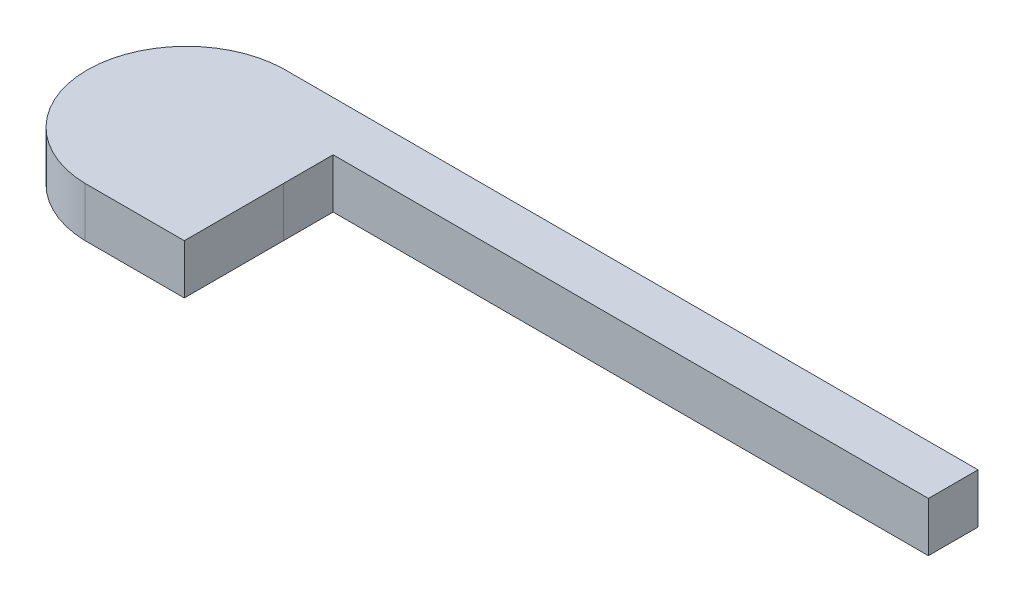
from build123d import *

# Parameters (mm, degrees)
SKETCH2_W               = 101.6
SKETCH2_H               = 25.4
BOSS_EXTRUDE1_DEPTH     = 6.35
SKETCH3_R               = 6.35
CUT_EXTRUDE1_DEPTH      = 3.81
CUT_EXTRUDE2_DEPTH      = 53.74706153
CUT_EXTRUDE2_DEPTH_BACK = 6.35
CUT_EXTRUDE3_DEPTH      = 53.74706153
CUT_EXTRUDE3_DEPTH_BACK = 6.35


with BuildPart() as part:
    # Sketch2 → Boss-Extrude1 (new body)
    with BuildSketch(Plane(origin=(0, 0, 0), x_dir=(1, 0, 0), z_dir=(0, 1, 0))):
        Rectangle(SKETCH2_W, SKETCH2_H)
    extrude(amount=BOSS_EXTRUDE1_DEPTH)

    # Sketch3 → Cut-Extrude1 (cut)
    with BuildSketch(Plane.XZ):
        with Locations(Location((-38.1, 0, 0), (0, 0, 270))):
            Circle(SKETCH3_R)
    extrude(amount=-CUT_EXTRUDE1_DEPTH, mode=Mode.SUBTRACT)

    # Sketch4 → Cut-Extrude2 (cut, two sides: drawn at the far end of the back side and taken through both)
    with BuildSketch(Plane(origin=(0, 6.35, 0), x_dir=(1, 0, 0), z_dir=(0, 1, 0)).offset(-CUT_EXTRUDE2_DEPTH_BACK)):
        Polygon((267.54102157, 6.35), (50.8, 6.35), (-25.4, 6.35), (-25.4, 0), (-25.4, -12.7), (-25.4, -229.44102157), (246.403770405, -567.12340506), (539.344791976, -331.332383489), align=None)
    extrude(amount=CUT_EXTRUDE2_DEPTH + CUT_EXTRUDE2_DEPTH_BACK, mode=Mode.SUBTRACT)

    # Sketch5 → Cut-Extrude3 (cut, two sides: drawn at the far end of the back side and taken through both)
    with BuildSketch(Plane(origin=(0, 6.35, 0), x_dir=(1, 0, 0), z_dir=(0, 1, 0)).offset(-CUT_EXTRUDE3_DEPTH_BACK)):
        with BuildLine():
            Line((156.775019491, -16.637334418), (-38.1, -12.7))
            ThreePointArc((-38.1, -12.7), (-50.545995938, 0), (-38.1, 12.7))
            Line((-38.1, 12.7), (156.775019491, 16.637334418))
            Line((156.775019491, 16.637334418), (-233.054562885, 16.637334418))
            Line((-233.054562885, 16.637334418), (-233.054562885, -16.637334418))
            Line((-233.054562885, -16.637334418), (156.775019491, -16.637334418))
        make_face()
    extrude(amount=CUT_EXTRUDE3_DEPTH + CUT_EXTRUDE3_DEPTH_BACK, mode=Mode.SUBTRACT)


solid = part.part
